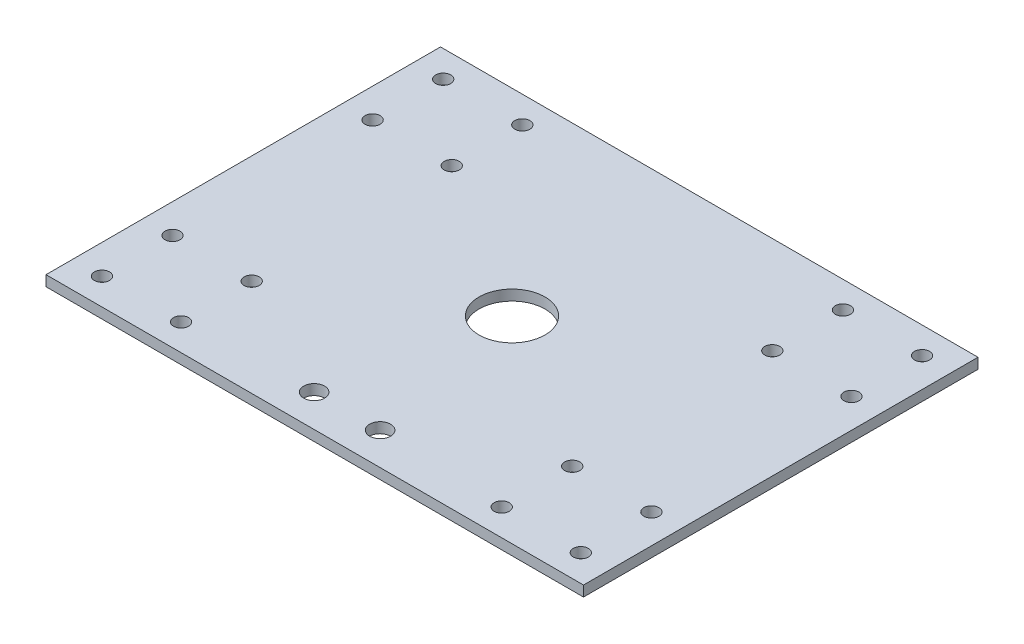
from build123d import *

# Parameters (mm, degrees)
SKETCH1_W                      = 163
SKETCH1_H                      = 119.634
BOSS_EXTRUDE1_DEPTH            = 3.175
SKETCH2_R                      = 2.286
CUT_EXTRUDE1_DEPTH             = 102.145460175
MIRROR2_COPY_1_SKETCH_R        = 2.286
MIRROR2_COPY_1_DEPTH           = 102.145460175
SKETCH3_R                      = 10
CUT_EXTRUDE2_DEPTH             = 102.145460175
F_1_16_0_0625_DIAMETER_HOLE1_D = 6.35


with BuildPart() as part:
    # Sketch1 → Boss-Extrude1 (new body)
    with BuildSketch(Plane(origin=(0, 0, 0), x_dir=(1, 0, 0), z_dir=(0, 1, 0))):
        Rectangle(SKETCH1_W, SKETCH1_H)
    extrude(amount=BOSS_EXTRUDE1_DEPTH)

    # Sketch2 → Cut-Extrude1 (cut, through all)
    with BuildSketch(Plane(origin=(0, 3.175, 0), x_dir=(1, 0, 0), z_dir=(0, 1, 0))):
        with Locations(Location((72.61, -51.7398, 0), (0, 0, 270))):
            Circle(SKETCH2_R)
        with Locations(Location((48.61, -51.7398, 0), (0, 0, 270))):
            Circle(SKETCH2_R)
        with Locations(Location((48.61, -30.3398, 0), (0, 0, 270))):
            Circle(SKETCH2_R)
        with Locations(Location((72.61, -30.3398, 0), (0, 0, 270))):
            Circle(SKETCH2_R)
    cut_extrude1 = extrude(amount=-CUT_EXTRUDE1_DEPTH, mode=Mode.SUBTRACT)

    # Mirror1: Cut-Extrude1 across plane
    add(cut_extrude1.mirror(Plane.XY), mode=Mode.SUBTRACT)

    # Mirror2: Cut-Extrude1 across plane
    add(cut_extrude1.mirror(Plane(origin=(0, 0, 0), x_dir=(0, 0, 1), z_dir=(1, 0, 0))), mode=Mode.SUBTRACT)

    # Mirror2 copy 1 sketch → Mirror2 copy 1 (cut, through all)
    with BuildSketch(Plane(origin=(0, 3.175, 0), x_dir=(-1, 0, 0), z_dir=(0, 1, 0))):
        with Locations(Location((72.61, -51.7398, 0), (0, 0, 270))):
            Circle(MIRROR2_COPY_1_SKETCH_R)
        with Locations(Location((48.61, -51.7398, 0), (0, 0, 270))):
            Circle(MIRROR2_COPY_1_SKETCH_R)
        with Locations(Location((48.61, -30.3398, 0), (0, 0, 270))):
            Circle(MIRROR2_COPY_1_SKETCH_R)
        with Locations(Location((72.61, -30.3398, 0), (0, 0, 270))):
            Circle(MIRROR2_COPY_1_SKETCH_R)
    extrude(amount=-MIRROR2_COPY_1_DEPTH, mode=Mode.SUBTRACT)

    # Sketch3 → Cut-Extrude2 (cut, through all)
    with BuildSketch(Plane(origin=(0, 3.175, 0), x_dir=(1, 0, 0), z_dir=(0, 1, 0))):
        with Locations(Location((0, 0, 0), (0, 0, 270))):
            Circle(SKETCH3_R)
    extrude(amount=-CUT_EXTRUDE2_DEPTH, mode=Mode.SUBTRACT)

    # 1/16 (0.0625) Diameter Hole1 (through all)
    with Locations(Plane(origin=(0, 3.175, 0), x_dir=(1, 0, 0), z_dir=(0, 1, 0))):
        with Locations((-10, -50), (10, -50)):
            Hole(F_1_16_0_0625_DIAMETER_HOLE1_D / 2)


solid = part.part
